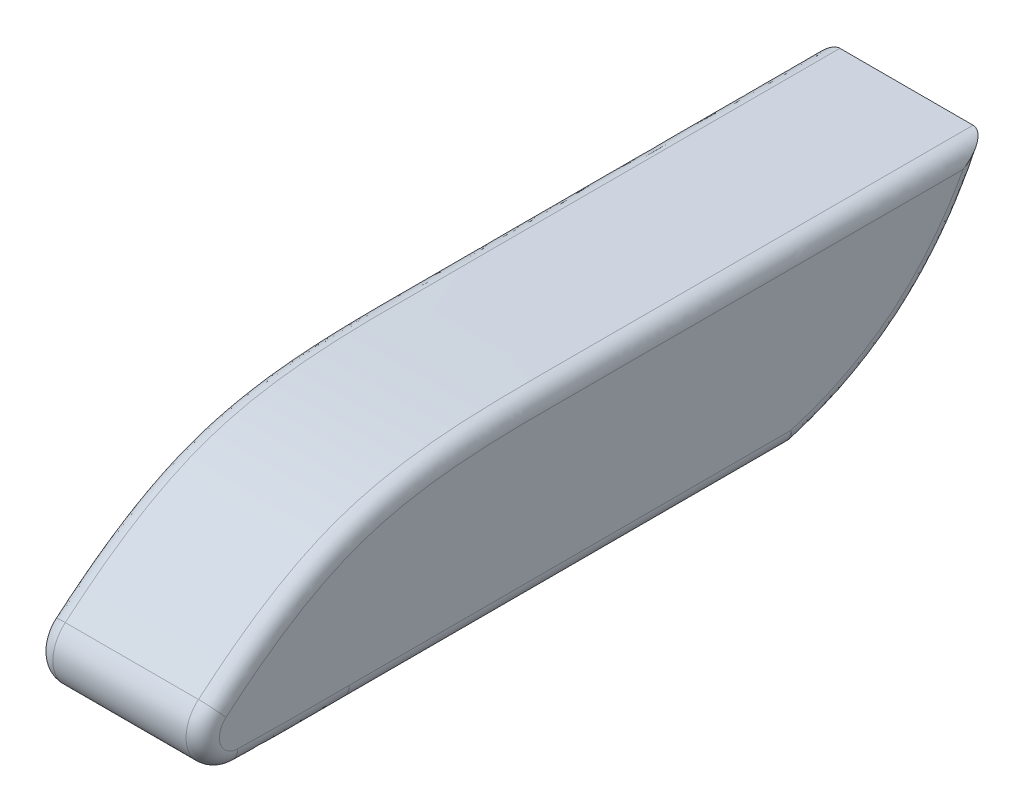
from build123d import *

# Parameters (mm, degrees)
SKETCH1_W           = 150
SKETCH1_H           = 125
BOSS_EXTRUDE1_DEPTH = 400
BOSS_EXTRUDE2_DEPTH = 150
FILLET1_R           = 15


with BuildPart() as part:
    # Sketch1 → Boss-Extrude1 (new body)
    with BuildSketch(Plane.XY):
        with Locations((5.104712042, 9.358638743)):
            Rectangle(SKETCH1_W, SKETCH1_H)
    extrude(amount=BOSS_EXTRUDE1_DEPTH)

    # Sketch2 → Boss-Extrude2 (add)
    with BuildSketch(Plane(origin=(80.104712042, 0, 0), x_dir=(0, 0, -1), z_dir=(1, 0, 0))):
        with BuildLine():
            Line((-400, -53.141361257), (0, -53.141361257))
            add(Edge.make_bspline(
                [(0, -53.141361257), (122.288338017, -18.619021444), (176.964235869, 102.858638743)],
                knots=[0, 0, 0, 1, 1, 1], degree=2))
            add(Edge.make_bspline(
                [(-520.88315384, 3.739549054), (-484.281057652, 34.995738584), (-387.309538261, 103.237642061), (-208.339003063, 102.760219206), (-17.590366689, 102.896229397), (108.746325141, 102.841826935), (176.964235869, 102.858638743)],
                knots=[0, 0, 0, 0, 0.198053711, 0.477754948, 0.715158663, 1, 1, 1, 1], degree=3))
            ThreePointArc((-520.88315384, 3.739549054), (-530.214713472, -31.267645456), (-500.818521198, -52.444178516))
            add(Edge.make_bspline(
                [(-400, -53.141361257), (-455.547087642, -53.141361257), (-454.186323559, -53.41255503), (-500.818521198, -52.444178516)],
                knots=[0, 0, 0, 0, 1, 1, 1, 1], degree=3))
        make_face()
    extrude(amount=-BOSS_EXTRUDE2_DEPTH)

    # Fillet1
    fillet1_edges = [part.edges().sort_by_distance(p)[0] for p in [
        (80.104712042, -53.167345947, 450.412235369),
        (80.104712042, 4.189858022, -106.59131419),
        (80.104712042, 102.847296332, 184.522460856),
        (80.104712042, -31.267645456, 530.214713472),
        (-69.895287958, -53.167345947, 450.412235369),
        (-69.895287958, -31.267645456, 530.214713472),
        (-69.895287958, 102.847296332, 184.522460856),
        (-69.895287958, 4.189858022, -106.59131419),
        (5.104712042, -53.141361257, 0),
        (80.104712042, -53.141361257, 200),
        (-69.895287958, -53.141361257, 200),
    ]]
    fillet(fillet1_edges, radius=FILLET1_R)


solid = part.part
